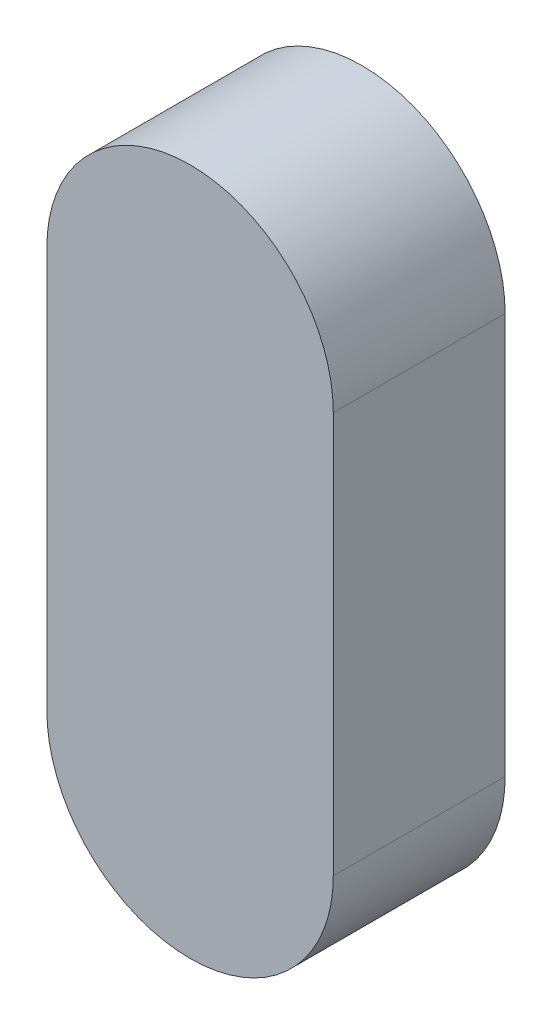
from build123d import *

# Parameters (mm, degrees)
BOSS_EXTRUDE1_DEPTH = 3


with BuildPart() as part:
    # Sketch1 → Boss-Extrude1 (new body)
    with BuildSketch(Plane.XY):
        with BuildLine():
            Line((-2.5, -3.5), (-2.5, 3.5))
            ThreePointArc((-2.5, 3.5), (0, 6), (2.5, 3.5))
            Line((2.5, 3.5), (2.5, -3.5))
            ThreePointArc((2.5, -3.5), (0, -6), (-2.5, -3.5))
        make_face()
    extrude(amount=BOSS_EXTRUDE1_DEPTH)


solid = part.part
